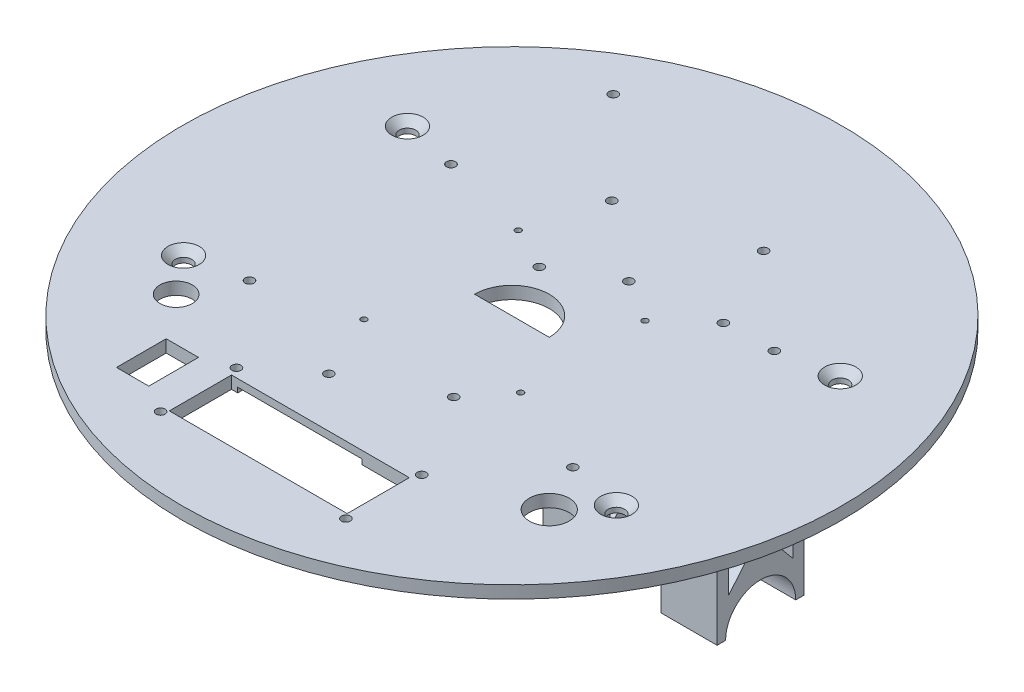
from build123d import *

# Parameters (mm, degrees)
CROQUIS1_R                                           = 132.5
SALIENTE_EXTRUIR1_DEPTH                              = 5
AVELLANADO_PARA_TORNILLO_CON_CABEZA_PLAN_D           = 6.6
AVELLANADO_PARA_TORNILLO_CON_CABEZA_PLAN_CSINK_D     = 12.6
AVELLANADO_PARA_TORNILLO_CON_CABEZA_PLAN_CSINK_ANGLE = 90
AVELLANADO_PARA_TORNILLO_CON_CABEZA_2_D              = 2.4
AVELLANADO_PARA_TORNILLO_CON_CABEZA_2_CSINK_D        = 4.4
AVELLANADO_PARA_TORNILLO_CON_CABEZA_2_CSINK_ANGLE    = 90
CORTAR_EXTRUIR1_DEPTH                                = 5
CROQUIS20_W                                          = 70
CROQUIS20_H                                          = 35
SALIENTE_EXTRUIR2_DEPTH                              = 51
CORTAR_EXTRUIR3_REACH                                = 274.422
TALADRO_DE_MARGEN_PARA_M131_D                        = 16
CORTAR_EXTRUIR4_REACH                                = 208.536
CROQUIS24_W                                          = 25
CROQUIS24_H                                          = 51
CHAFL_N1_SIZE                                        = 3
CROQUIS25_W                                          = 71.5
CROQUIS25_H                                          = 25
CORTAR_EXTRUIR5_DEPTH                                = 5
TALADRO_DE_MARGEN_PARA_M31_D                         = 3.6
CROQUIS26_W                                          = 6
CROQUIS26_H                                          = 19
CORTAR_EXTRUIR6_DEPTH                                = 3.5
CROQUIS27_W                                          = 50
CROQUIS27_H                                          = 8
CORTAR_EXTRUIR7_DEPTH                                = 2
CROQUIS28_W                                          = 13
CROQUIS28_H                                          = 20
CORTAR_EXTRUIR8_DEPTH                                = 5
CROQUIS29_R                                          = 6.5
CORTAR_EXTRUIR9_DEPTH                                = 5
AVELLANADO_PARA_TORNILLO_CON_CABEZA_3_D              = 3.6
AVELLANADO_PARA_TORNILLO_CON_CABEZA_3_CSINK_D        = 6.3
AVELLANADO_PARA_TORNILLO_CON_CABEZA_3_CSINK_ANGLE    = 90
AVELLANADO_PARA_TORNILLO_CON_CABEZA_4_D              = 3.6
AVELLANADO_PARA_TORNILLO_CON_CABEZA_4_CSINK_D        = 6.3
AVELLANADO_PARA_TORNILLO_CON_CABEZA_4_CSINK_ANGLE    = 90
AVELLANADO_PARA_TORNILLO_CON_CABEZA_5_D              = 3.6
AVELLANADO_PARA_TORNILLO_CON_CABEZA_5_CSINK_D        = 6.3
AVELLANADO_PARA_TORNILLO_CON_CABEZA_5_CSINK_ANGLE    = 90
AVELLANADO_PARA_TORNILLO_CON_CABEZA_6_D              = 3.6
AVELLANADO_PARA_TORNILLO_CON_CABEZA_6_CSINK_D        = 6.3
AVELLANADO_PARA_TORNILLO_CON_CABEZA_6_CSINK_ANGLE    = 90
AVELLANADO_PARA_TORNILLO_CON_CABEZA_7_D              = 3.6
AVELLANADO_PARA_TORNILLO_CON_CABEZA_7_CSINK_D        = 6.3
AVELLANADO_PARA_TORNILLO_CON_CABEZA_7_CSINK_ANGLE    = 90
CROQUIS41_R                                          = 3.75
SALIENTE_EXTRUIR3_DEPTH                              = 15
CROQUIS42_R                                          = 2
CORTAR_EXTRUIR10_DEPTH                               = 6.5


with BuildPart() as part:
    # Croquis1 → Saliente-Extruir1 (new body)
    with BuildSketch(Plane(origin=(0, 0, 0), x_dir=(1, 0, 0), z_dir=(0, 1, 0))):
        with Locations(Location((0, 0, 0), (0, 0, 270))):
            Circle(CROQUIS1_R)
    extrude(amount=SALIENTE_EXTRUIR1_DEPTH)

    # Avellanado para tornillo con cabeza plan (through all)
    with Locations(Plane(origin=(0, 5, 0), x_dir=(1, 0, 0), z_dir=(0, 1, 0))):
        with Locations((-87, -45), (87, -45), (87, 45), (-87, 45)):
            CounterSinkHole(AVELLANADO_PARA_TORNILLO_CON_CABEZA_PLAN_D / 2, AVELLANADO_PARA_TORNILLO_CON_CABEZA_PLAN_CSINK_D / 2, counter_sink_angle=AVELLANADO_PARA_TORNILLO_CON_CABEZA_PLAN_CSINK_ANGLE)

    # Avellanado para tornillo con cabeza  2 (through all)
    with Locations(Plane(origin=(0, 0, 0), x_dir=(-1, 0, 0), z_dir=(0, -1, 0))):
        with Locations((-28.5, 25), (28.5, 31), (-28.5, -25), (28.5, -31)):
            CounterSinkHole(AVELLANADO_PARA_TORNILLO_CON_CABEZA_2_D / 2, AVELLANADO_PARA_TORNILLO_CON_CABEZA_2_CSINK_D / 2, counter_sink_angle=AVELLANADO_PARA_TORNILLO_CON_CABEZA_2_CSINK_ANGLE)

    # Croquis18 → Cortar-Extruir1 (cut)
    with BuildSketch(Plane.XZ):
        with BuildLine():
            Line((-15, 0), (15, 0))
            ThreePointArc((15, 0), (0, -15), (-15, 0))
        make_face()
    extrude(amount=-CORTAR_EXTRUIR1_DEPTH, mode=Mode.SUBTRACT)

    # Croquis20 → Saliente-Extruir2 (add)
    with BuildSketch(Plane.XZ):
        with Locations((65, 0)):
            Rectangle(CROQUIS20_W, CROQUIS20_H)
        with Locations((-65, 0)):
            Rectangle(CROQUIS20_W, CROQUIS20_H)
    extrude(amount=SALIENTE_EXTRUIR2_DEPTH)

    # Cortar-Extruir3: up to this face of the body (flat: up to its plane)
    cortar_extruir3_end = Plane(part.part.faces().sort_by_distance((-100, -25.5, 0))[0])
    # Croquis21 → Cortar-Extruir3 (cut, up to the picked face)
    with BuildSketch(Plane(origin=(100, 0, 0), x_dir=(0, 0, -1), z_dir=(1, 0, 0)), mode=Mode.PRIVATE) as cortar_extruir3_sk1:
        with BuildLine():
            Line((-14.1, -51), (14.1, -51))
            ThreePointArc((14.1, -51), (0, -36.9), (-14.1, -51))
        make_face()
    cortar_extruir3_tool1 = split(extrude(cortar_extruir3_sk1.sketch, amount=-CORTAR_EXTRUIR3_REACH, mode=Mode.PRIVATE), bisect_by=cortar_extruir3_end, keep=Keep.BOTH, mode=Mode.PRIVATE)
    # Croquis21 → Cortar-Extruir3 (cut, up to the picked face)
    with BuildSketch(Plane(origin=(100, 0, 0), x_dir=(0, 0, -1), z_dir=(1, 0, 0)), mode=Mode.PRIVATE) as cortar_extruir3_sk2:
        Polygon((-3, -6), (-13, -6), (-13, -36), (-3, -24.082464074), align=None)
    cortar_extruir3_tool2 = split(extrude(cortar_extruir3_sk2.sketch, amount=-CORTAR_EXTRUIR3_REACH, mode=Mode.PRIVATE), bisect_by=cortar_extruir3_end, keep=Keep.BOTH, mode=Mode.PRIVATE)
    # Croquis21 → Cortar-Extruir3 (cut, up to the picked face)
    with BuildSketch(Plane(origin=(100, 0, 0), x_dir=(0, 0, -1), z_dir=(1, 0, 0)), mode=Mode.PRIVATE) as cortar_extruir3_sk3:
        Polygon((3, -6), (3, -24.082464074), (13, -36), (13, -6), align=None)
    cortar_extruir3_tool3 = split(extrude(cortar_extruir3_sk3.sketch, amount=-CORTAR_EXTRUIR3_REACH, mode=Mode.PRIVATE), bisect_by=cortar_extruir3_end, keep=Keep.BOTH, mode=Mode.PRIVATE)
    add(cortar_extruir3_tool1.solids().sort_by(Axis((100, -45.015774, 0), (-1, 0, 0)))[0], mode=Mode.SUBTRACT)
    add(cortar_extruir3_tool2.solids().sort_by(Axis((100, -18.266769, 8.413094), (-1, 0, 0)))[0], mode=Mode.SUBTRACT)
    add(cortar_extruir3_tool3.solids().sort_by(Axis((100, -18.266769, -8.413094), (-1, 0, 0)))[0], mode=Mode.SUBTRACT)

    # Taladro de margen para M131 (through all)
    with Locations(Plane(origin=(0, 5, 0), x_dir=(1, 0, 0), z_dir=(0, 1, 0))):
        with Locations((75, -60)):
            Hole(TALADRO_DE_MARGEN_PARA_M131_D / 2)

    # Cortar-Extruir4: up to this face of the body (flat: up to its plane)
    cortar_extruir4_end = Plane(part.part.faces().sort_by_distance((-65, -25.5, -17.5))[0])
    # Croquis24 → Cortar-Extruir4 (cut, up to the picked face)
    with BuildSketch(Plane.XY.offset(17.5), mode=Mode.PRIVATE) as cortar_extruir4_sk1:
        with Locations((-65, -25.5)):
            Rectangle(CROQUIS24_W, CROQUIS24_H)
    cortar_extruir4_tool1 = split(extrude(cortar_extruir4_sk1.sketch, amount=-CORTAR_EXTRUIR4_REACH, mode=Mode.PRIVATE), bisect_by=cortar_extruir4_end, keep=Keep.BOTH, mode=Mode.PRIVATE)
    # Croquis24 → Cortar-Extruir4 (cut, up to the picked face)
    with BuildSketch(Plane.XY.offset(17.5), mode=Mode.PRIVATE) as cortar_extruir4_sk2:
        with Locations((65, -25.5)):
            Rectangle(CROQUIS24_W, CROQUIS24_H)
    cortar_extruir4_tool2 = split(extrude(cortar_extruir4_sk2.sketch, amount=-CORTAR_EXTRUIR4_REACH, mode=Mode.PRIVATE), bisect_by=cortar_extruir4_end, keep=Keep.BOTH, mode=Mode.PRIVATE)
    add(cortar_extruir4_tool1.solids().sort_by(Axis((-65, -25.5, 17.5), (0, 0, -1)))[0], mode=Mode.SUBTRACT)
    add(cortar_extruir4_tool2.solids().sort_by(Axis((65, -25.5, 17.5), (0, 0, -1)))[0], mode=Mode.SUBTRACT)

    # Chaflán1
    chafl_n1_edges = [part.edges().sort_by_distance(p)[0] for p in [
        (-41.25, 0, -17.5),
        (-88.75, 0, 17.5),
        (88.75, 0, -17.5),
        (41.25, 0, 17.5),
        (100, 0, 0),
        (88.75, 0, 17.5),
        (30, 0, 0),
        (41.25, 0, -17.5),
        (-30, 0, 0),
        (-41.25, 0, 17.5),
        (-100, 0, 0),
        (-88.75, 0, -17.5),
    ]]
    chamfer(chafl_n1_edges, length=CHAFL_N1_SIZE)

    # Croquis25 → Cortar-Extruir5 (cut)
    with BuildSketch(Plane(origin=(0, 5, 0), x_dir=(1, 0, 0), z_dir=(0, 1, 0))):
        with Locations((0, -89.5)):
            Rectangle(CROQUIS25_W, CROQUIS25_H)
    extrude(amount=-CORTAR_EXTRUIR5_DEPTH, mode=Mode.SUBTRACT)

    # Taladro de margen para M31 (through all)
    with Locations(Plane(origin=(0, 0, 0), x_dir=(-1, 0, 0), z_dir=(0, -1, 0))):
        with Locations((37.25, -104), (-37.25, -104), (37.25, -73.5), (-37.25, -73.5)):
            Hole(TALADRO_DE_MARGEN_PARA_M31_D / 2)

    # Croquis26 → Cortar-Extruir6 (cut)
    with BuildSketch(Plane.XZ):
        with Locations((38.75, 89.5)):
            Rectangle(CROQUIS26_W, CROQUIS26_H)
    extrude(amount=-CORTAR_EXTRUIR6_DEPTH, mode=Mode.SUBTRACT)

    # Croquis27 → Cortar-Extruir7 (cut)
    with BuildSketch(Plane.XZ):
        with Locations((-8.25, 73)):
            Rectangle(CROQUIS27_W, CROQUIS27_H)
    extrude(amount=-CORTAR_EXTRUIR7_DEPTH, mode=Mode.SUBTRACT)

    # Croquis28 → Cortar-Extruir8 (cut)
    with BuildSketch(Plane.XZ):
        with Locations((-55, 87.5)):
            Rectangle(CROQUIS28_W, CROQUIS28_H)
    extrude(amount=-CORTAR_EXTRUIR8_DEPTH, mode=Mode.SUBTRACT)

    # Croquis29 → Cortar-Extruir9 (cut)
    with BuildSketch(Plane(origin=(0, 5, 0), x_dir=(1, 0, 0), z_dir=(0, 1, 0))):
        with Locations(Location((-75, -60, 0), (0, 0, 270))):
            Circle(CROQUIS29_R)
    extrude(amount=-CORTAR_EXTRUIR9_DEPTH, mode=Mode.SUBTRACT)

    # Avellanado para tornillo con cabeza  3 (through all)
    with Locations(Plane(origin=(0, 0, 0), x_dir=(-1, 0, 0), z_dir=(0, -1, 0))):
        with Locations((65, 40.5), (65, -40.5), (-65, -40.5), (-65, 40.5)):
            CounterSinkHole(AVELLANADO_PARA_TORNILLO_CON_CABEZA_3_D / 2, AVELLANADO_PARA_TORNILLO_CON_CABEZA_3_CSINK_D / 2, counter_sink_angle=AVELLANADO_PARA_TORNILLO_CON_CABEZA_3_CSINK_ANGLE)

    # Avellanado para tornillo con cabeza  4 (through all)
    with Locations(Plane(origin=(0, 0, 0), x_dir=(-1, 0, 0), z_dir=(0, -1, 0))):
        with Locations((56.74, 97.5), (20, 60.12)):
            CounterSinkHole(AVELLANADO_PARA_TORNILLO_CON_CABEZA_4_D / 2, AVELLANADO_PARA_TORNILLO_CON_CABEZA_4_CSINK_D / 2, counter_sink_angle=AVELLANADO_PARA_TORNILLO_CON_CABEZA_4_CSINK_ANGLE)

    # Avellanado para tornillo con cabeza  5 (through all)
    with Locations(Plane(origin=(0, 0, 0), x_dir=(-1, 0, 0), z_dir=(0, -1, 0))):
        with Locations((-28, 73.18), (-45, 40)):
            CounterSinkHole(AVELLANADO_PARA_TORNILLO_CON_CABEZA_5_D / 2, AVELLANADO_PARA_TORNILLO_CON_CABEZA_5_CSINK_D / 2, counter_sink_angle=AVELLANADO_PARA_TORNILLO_CON_CABEZA_5_CSINK_ANGLE)

    # Avellanado para tornillo con cabeza  6 (through all)
    with Locations(Plane(origin=(0, 0, 0), x_dir=(-1, 0, 0), z_dir=(0, -1, 0))):
        with Locations((16.59, -57), (-16.59, -40)):
            CounterSinkHole(AVELLANADO_PARA_TORNILLO_CON_CABEZA_6_D / 2, AVELLANADO_PARA_TORNILLO_CON_CABEZA_6_CSINK_D / 2, counter_sink_angle=AVELLANADO_PARA_TORNILLO_CON_CABEZA_6_CSINK_ANGLE)

    # Avellanado para tornillo con cabeza  7 (through all)
    with Locations(Plane(origin=(0, 0, 0), x_dir=(-1, 0, 0), z_dir=(0, -1, 0))):
        with Locations((11.5, 22.5), (-11.5, 35.5)):
            CounterSinkHole(AVELLANADO_PARA_TORNILLO_CON_CABEZA_7_D / 2, AVELLANADO_PARA_TORNILLO_CON_CABEZA_7_CSINK_D / 2, counter_sink_angle=AVELLANADO_PARA_TORNILLO_CON_CABEZA_7_CSINK_ANGLE)

    # Croquis41 → Saliente-Extruir3 (add)
    with BuildSketch(Plane(origin=(0, 0, 0), x_dir=(-1, 0, 0), z_dir=(0, -1, 0))):
        with Locations(Location((7.753, -5.24, 0), (0, 0, 270))):
            Circle(CROQUIS41_R)
        with Locations(Location((-7.807, -5.24, 0), (0, 0, 270))):
            Circle(CROQUIS41_R)
    extrude(amount=SALIENTE_EXTRUIR3_DEPTH)

    # Croquis42 → Cortar-Extruir10 (cut)
    with BuildSketch(Plane(origin=(0, -15, 0), x_dir=(-1, 0, 0), z_dir=(0, -1, 0))):
        with Locations(Location((7.753, -5.24, 0), (0, 0, 90))):
            Circle(CROQUIS42_R)
        with Locations(Location((-7.807, -5.24, 0), (0, 0, 90))):
            Circle(CROQUIS42_R)
    extrude(amount=-CORTAR_EXTRUIR10_DEPTH, mode=Mode.SUBTRACT)


solid = part.part
